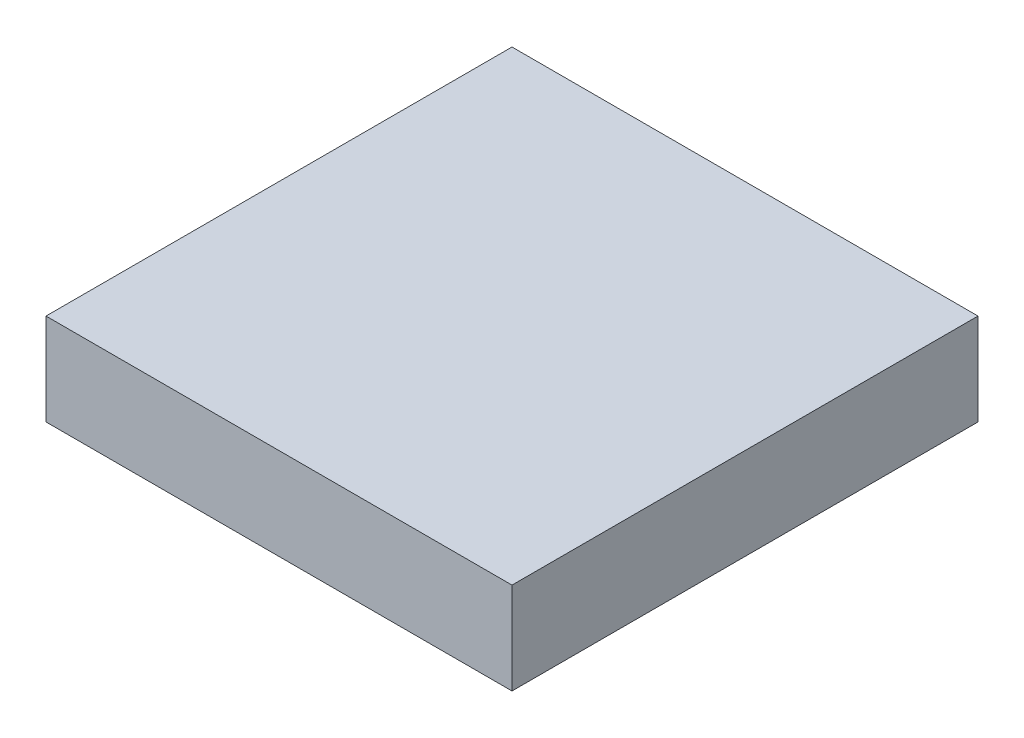
from build123d import *

# Parameters (mm, degrees)
SKETCH1_W           = 25.4
SKETCH1_H           = 25.4
BOSS_EXTRUDE1_DEPTH = 5


with BuildPart() as part:
    # Sketch1 → Boss-Extrude1 (new body)
    with BuildSketch(Plane(origin=(0, 0, 0), x_dir=(1, 0, 0), z_dir=(0, 1, 0))):
        Rectangle(SKETCH1_W, SKETCH1_H)
    extrude(amount=BOSS_EXTRUDE1_DEPTH)


solid = part.part
